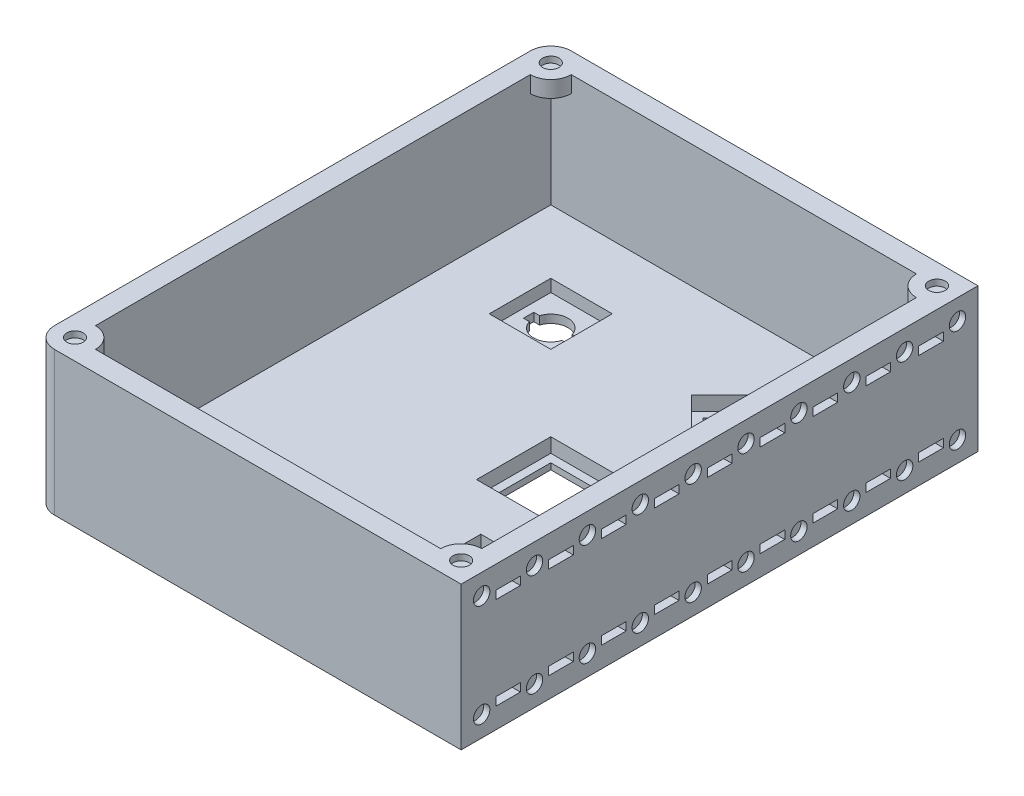
from build123d import *

# Parameters (mm, degrees)
SKETCH1_W               = 14.1
SKETCH1_H               = 14.1
BOSS_EXTRUDE1_DEPTH     = 5
BOSS_EXTRUDE2_START     = 30
SKETCH1_3_W             = 188.3
SKETCH1_3_H             = 116
BOSS_EXTRUDE2_DEPTH     = 30
SKETCH3_W               = 18.1
SKETCH3_H               = 18.1
CUT_EXTRUDE1_DEPTH      = 3.5
CUT_EXTRUDE2_DEPTH      = 231.718204743
CUT_EXTRUDE2_DEPTH_BACK = 231.718204743
SKETCH4_W               = 163.599092171
SKETCH4_H               = 164.279164307
SKETCH5_W               = 5
SKETCH5_H               = 126
BOSS_EXTRUDE3_DEPTH     = 35
BOSS_EXTRUDE4_DEPTH     = 4
CUT_EXTRUDE5_DEPTH      = 1.5
SKETCH9_W               = 15
SKETCH9_H               = 15
CUT_EXTRUDE6_DEPTH      = 3
SKETCH11_R              = 2
CUT_EXTRUDE7_DEPTH      = 1.5
LPATTERN1_COUNT         = 10
LPATTERN1_PITCH         = 12.888888889
LPATTERN1_COUNT_DIR2    = 2
LPATTERN1_PITCH_DIR2    = 25
SKETCH12_W              = 6
SKETCH12_H              = 2
CUT_EXTRUDE8_DEPTH      = 5
LPATTERN2_COUNT         = 9
LPATTERN2_PITCH         = 12.888888889
LPATTERN2_COUNT_DIR2    = 2
LPATTERN2_PITCH_DIR2    = 22.5


with BuildPart() as part:
    # Sketch1 → Boss-Extrude1 (new body)
    with BuildSketch(Plane(origin=(0, 0, 0), x_dir=(1, 0, 0), z_dir=(0, 1, 0))):
        with BuildLine():
            Line((-5, 116), (-5, 0))
            ThreePointArc((-5, 0), (-3.535533906, -3.535533906), (0, -5))
            Line((0, -5), (188.3, -5))
            ThreePointArc((188.3, -5), (191.835533906, -3.535533906), (193.3, 0))
            Line((193.3, 0), (193.3, 116))
            ThreePointArc((193.3, 116), (191.835533906, 119.535533906), (188.3, 121))
            Line((188.3, 121), (0, 121))
            ThreePointArc((0, 121), (-3.535533906, 119.535533906), (-5, 116))
        make_face()
        with Locations((58, 58)):
            Rectangle(SKETCH1_W, SKETCH1_H, mode=Mode.SUBTRACT)
        with Locations((82.1, 58)):
            Rectangle(SKETCH1_W, SKETCH1_H, mode=Mode.SUBTRACT)
        with Locations((70.05, 28.9)):
            Rectangle(SKETCH1_W, SKETCH1_H, mode=Mode.SUBTRACT)
        with Locations((118.25, 28.9)):
            Rectangle(SKETCH1_W, SKETCH1_H, mode=Mode.SUBTRACT)
        with Locations((106.2, 58)):
            Rectangle(SKETCH1_W, SKETCH1_H, mode=Mode.SUBTRACT)
        with Locations((130.3, 58)):
            Rectangle(SKETCH1_W, SKETCH1_H, mode=Mode.SUBTRACT)
        Polygon((80.020205615, 93), (70.05, 83.029794385), (60.079794385, 93), (70.05, 102.970205615), align=None, mode=Mode.SUBTRACT)
        Polygon((108.279794385, 93), (118.25, 102.970205615), (128.220205615, 93), (118.25, 83.029794385), align=None, mode=Mode.SUBTRACT)
        with BuildLine():
            Line((17.6, 94.25), (19.016518483, 94.25))
            ThreePointArc((19.016518483, 94.25), (23, 97.175), (26.983481517, 94.25))
            Line((26.983481517, 94.25), (28.4, 94.25))
            Line((28.4, 94.25), (28.4, 91.75))
            Line((28.4, 91.75), (26.983481517, 91.75))
            ThreePointArc((26.983481517, 91.75), (23, 88.825), (19.016518483, 91.75))
            Line((19.016518483, 91.75), (17.6, 91.75))
            Line((17.6, 91.75), (17.6, 94.25))
        make_face(mode=Mode.SUBTRACT)
        with BuildLine():
            Line((170.7, 91.75), (169.283481517, 91.75))
            ThreePointArc((169.283481517, 91.75), (165.3, 88.825), (161.316518483, 91.75))
            Line((161.316518483, 91.75), (159.9, 91.75))
            Line((159.9, 91.75), (159.9, 94.25))
            Line((159.9, 94.25), (161.316518483, 94.25))
            ThreePointArc((161.316518483, 94.25), (165.3, 97.175), (169.283481517, 94.25))
            Line((169.283481517, 94.25), (170.7, 94.25))
            Line((170.7, 94.25), (170.7, 91.75))
        make_face(mode=Mode.SUBTRACT)
    extrude(amount=-BOSS_EXTRUDE1_DEPTH)

    # Sketch1<3> → Boss-Extrude2 (add)
    with BuildSketch(Plane(origin=(0, 0, 0), x_dir=(1, 0, 0), z_dir=(0, 1, 0)).offset(BOSS_EXTRUDE2_START)):
        with BuildLine():
            Line((-5, 0), (-5, 116))
            ThreePointArc((-5, 116), (-3.535533906, 119.535533906), (0, 121))
            Line((0, 121), (188.3, 121))
            ThreePointArc((188.3, 121), (191.835533906, 119.535533906), (193.3, 116))
            Line((193.3, 116), (193.3, 0))
            ThreePointArc((193.3, 0), (191.835533906, -3.535533906), (188.3, -5))
            Line((188.3, -5), (0, -5))
            ThreePointArc((0, -5), (-3.535533906, -3.535533906), (-5, 0))
        make_face()
        with Locations((94.15, 58)):
            Rectangle(SKETCH1_3_W, SKETCH1_3_H, mode=Mode.SUBTRACT)
    extrude(amount=-BOSS_EXTRUDE2_DEPTH)

    # Sketch3 → Cut-Extrude1 (cut)
    with BuildSketch(Plane(origin=(0, 0, 0), x_dir=(1, 0, 0), z_dir=(0, 1, 0))):
        with Locations((58, 58)):
            Rectangle(SKETCH3_W, SKETCH3_H)
        Polygon((70.05, 105.798632739), (57.251367261, 93), (70.05, 80.201367261), (82.848632739, 93), align=None)
        with Locations((70.05, 28.9)):
            Rectangle(SKETCH3_W, SKETCH3_H)
        with Locations((82.1, 58)):
            Rectangle(SKETCH3_W, SKETCH3_H)
        with Locations((106.2, 58)):
            Rectangle(SKETCH3_W, SKETCH3_H)
        with Locations((130.3, 58)):
            Rectangle(SKETCH3_W, SKETCH3_H)
        Polygon((105.451367261, 93), (118.25, 80.201367261), (131.048632739, 93), (118.25, 105.798632739), align=None)
        with Locations((118.25, 28.9)):
            Rectangle(SKETCH3_W, SKETCH3_H)
    extrude(amount=-CUT_EXTRUDE1_DEPTH, mode=Mode.SUBTRACT)

    # Sketch4 → Cut-Extrude2 (cut, two sides: drawn at the far end of the back side and taken through both)
    with BuildSketch(Plane.XZ.offset(5).offset(-CUT_EXTRUDE2_DEPTH_BACK)):
        with Locations((175.949546086, -77.139582154)):
            Rectangle(SKETCH4_W, SKETCH4_H)
    extrude(amount=CUT_EXTRUDE2_DEPTH + CUT_EXTRUDE2_DEPTH_BACK, mode=Mode.SUBTRACT)

    # Sketch5 → Boss-Extrude3 (add)
    with BuildSketch(Plane.XZ.offset(5)):
        with Locations((96.65, -58)):
            Rectangle(SKETCH5_W, SKETCH5_H)
    extrude(amount=-BOSS_EXTRUDE3_DEPTH)

    # Sketch8 → Boss-Extrude4 (add)
    with BuildSketch(Plane(origin=(0, 30, 0), x_dir=(1, 0, 0), z_dir=(0, 1, 0))):
        with BuildLine():
            ThreePointArc((-5, 116), (-3.535533906, 112.464466094), (0, 111))
            Line((0, 111), (0, 114))
            ThreePointArc((0, 114), (-1.414213562, 117.414213562), (2, 116))
            Line((2, 116), (5, 116))
            ThreePointArc((5, 116), (3.535533906, 119.535533906), (0, 121))
            ThreePointArc((0, 121), (-3.535533906, 119.535533906), (-5, 116))
        make_face()
        with BuildLine():
            Line((0, 114), (0, 111))
            ThreePointArc((0, 111), (3.535533906, 112.464466094), (5, 116))
            Line((5, 116), (2, 116))
            ThreePointArc((2, 116), (1.414213562, 114.585786438), (0, 114))
        make_face()
        with BuildLine():
            Line((0, 116), (0, 114))
            ThreePointArc((0, 114), (1.414213562, 114.585786438), (2, 116))
            Line((2, 116), (0, 116))
        make_face()
        with BuildLine():
            ThreePointArc((2, 116), (-1.414213562, 117.414213562), (0, 114))
            Line((0, 114), (0, 116))
            Line((0, 116), (2, 116))
        make_face()
        with BuildLine():
            Line((92.15, 116), (89.15, 116))
            ThreePointArc((89.15, 116), (90.614466094, 112.464466094), (94.15, 111))
            Line((94.15, 111), (94.15, 114))
            ThreePointArc((94.15, 114), (92.735786438, 114.585786438), (92.15, 116))
        make_face()
        with BuildLine():
            ThreePointArc((99.15, 116), (94.15, 121), (89.15, 116))
            Line((89.15, 116), (92.15, 116))
            ThreePointArc((92.15, 116), (94.15, 118), (96.15, 116))
            ThreePointArc((96.15, 116), (95.564213562, 114.585786438), (94.15, 114))
            Line((94.15, 114), (94.15, 111))
            ThreePointArc((94.15, 111), (97.685533906, 112.464466094), (99.15, 116))
        make_face()
        with BuildLine():
            Line((94.15, 116), (92.15, 116))
            ThreePointArc((92.15, 116), (92.735786438, 114.585786438), (94.15, 114))
            Line((94.15, 114), (94.15, 116))
        make_face()
        with BuildLine():
            ThreePointArc((96.15, 116), (94.15, 118), (92.15, 116))
            Line((92.15, 116), (94.15, 116))
            Line((94.15, 116), (94.15, 114))
            ThreePointArc((94.15, 114), (95.564213562, 114.585786438), (96.15, 116))
        make_face()
        with BuildLine():
            Line((92.15, 0), (89.15, 0))
            ThreePointArc((89.15, 0), (94.15, -5), (99.15, 0))
            ThreePointArc((99.15, 0), (97.685533906, 3.535533906), (94.15, 5))
            Line((94.15, 5), (94.15, 2))
            ThreePointArc((94.15, 2), (95.564213562, 1.414213562), (96.15, 0))
            ThreePointArc((96.15, 0), (94.15, -2), (92.15, 0))
        make_face()
        with BuildLine():
            ThreePointArc((94.15, 5), (90.614466094, 3.535533906), (89.15, 0))
            Line((89.15, 0), (92.15, 0))
            ThreePointArc((92.15, 0), (92.735786438, 1.414213562), (94.15, 2))
            Line((94.15, 2), (94.15, 5))
        make_face()
        with BuildLine():
            Line((94.15, 0), (92.15, 0))
            ThreePointArc((92.15, 0), (94.15, -2), (96.15, 0))
            ThreePointArc((96.15, 0), (95.564213562, 1.414213562), (94.15, 2))
            Line((94.15, 2), (94.15, 0))
        make_face()
        with BuildLine():
            ThreePointArc((94.15, 2), (92.735786438, 1.414213562), (92.15, 0))
            Line((92.15, 0), (94.15, 0))
            Line((94.15, 0), (94.15, 2))
        make_face()
        with BuildLine():
            Line((0, 0), (0, 2))
            ThreePointArc((0, 2), (-1.414213562, -1.414213562), (2, 0))
            Line((2, 0), (0, 0))
        make_face()
        with BuildLine():
            ThreePointArc((2, 0), (1.414213562, 1.414213562), (0, 2))
            Line((0, 2), (0, 0))
            Line((0, 0), (2, 0))
        make_face()
        with BuildLine():
            ThreePointArc((0, 5), (-3.535533906, 3.535533906), (-5, 0))
            ThreePointArc((-5, 0), (-3.535533906, -3.535533906), (0, -5))
            ThreePointArc((0, -5), (3.535533906, -3.535533906), (5, 0))
            Line((5, 0), (2, 0))
            ThreePointArc((2, 0), (-1.414213562, -1.414213562), (0, 2))
            Line((0, 2), (0, 5))
        make_face()
        with BuildLine():
            ThreePointArc((5, 0), (3.535533906, 3.535533906), (0, 5))
            Line((0, 5), (0, 2))
            ThreePointArc((0, 2), (1.414213562, 1.414213562), (2, 0))
            Line((2, 0), (5, 0))
        make_face()
    extrude(amount=-BOSS_EXTRUDE4_DEPTH)

    # Sketch8<3> → Cut-Extrude5 (cut)
    with BuildSketch(Plane(origin=(0, 30, 0), x_dir=(1, 0, 0), z_dir=(0, 1, 0))):
        with BuildLine():
            Line((0, 0), (2, 0))
            ThreePointArc((2, 0), (1.414213562, 1.414213562), (0, 2))
            Line((0, 2), (0, 0))
        make_face()
        with BuildLine():
            ThreePointArc((0, 2), (-1.414213562, -1.414213562), (2, 0))
            Line((2, 0), (0, 0))
            Line((0, 0), (0, 2))
        make_face()
        with BuildLine():
            Line((0, 116), (0, 114))
            ThreePointArc((0, 114), (1.414213562, 114.585786438), (2, 116))
            Line((2, 116), (0, 116))
        make_face()
        with BuildLine():
            ThreePointArc((2, 116), (-1.414213562, 117.414213562), (0, 114))
            Line((0, 114), (0, 116))
            Line((0, 116), (2, 116))
        make_face()
        with BuildLine():
            Line((94.15, 116), (94.15, 114))
            ThreePointArc((94.15, 114), (95.564213562, 114.585786438), (96.15, 116))
            ThreePointArc((96.15, 116), (94.15, 118), (92.15, 116))
            Line((92.15, 116), (94.15, 116))
        make_face()
        with BuildLine():
            ThreePointArc((92.15, 116), (92.735786438, 114.585786438), (94.15, 114))
            Line((94.15, 114), (94.15, 116))
            Line((94.15, 116), (92.15, 116))
        make_face()
        with BuildLine():
            Line((94.15, 0), (92.15, 0))
            ThreePointArc((92.15, 0), (94.15, -2), (96.15, 0))
            ThreePointArc((96.15, 0), (95.564213562, 1.414213562), (94.15, 2))
            Line((94.15, 2), (94.15, 0))
        make_face()
        with BuildLine():
            ThreePointArc((94.15, 2), (92.735786438, 1.414213562), (92.15, 0))
            Line((92.15, 0), (94.15, 0))
            Line((94.15, 0), (94.15, 2))
        make_face()
    extrude(amount=-CUT_EXTRUDE5_DEPTH, mode=Mode.SUBTRACT)

    # Sketch9 → Cut-Extrude6 (cut)
    with BuildSketch(Plane(origin=(0, 0, 0), x_dir=(1, 0, 0), z_dir=(0, 1, 0))):
        with Locations((23, 93)):
            Rectangle(SKETCH9_W, SKETCH9_H)
    extrude(amount=-CUT_EXTRUDE6_DEPTH, mode=Mode.SUBTRACT)

    # Sketch11 → Cut-Extrude7 (cut)
    with BuildSketch(Plane(origin=(99.15, 0, 0), x_dir=(0, 0, -1), z_dir=(1, 0, 0))):
        Circle(SKETCH11_R)
    cut_extrude7 = extrude(amount=-CUT_EXTRUDE7_DEPTH, mode=Mode.SUBTRACT)

    # LPattern1: Cut-Extrude7 10 × 2
    with Locations(*[(0, j * LPATTERN1_PITCH_DIR2, -i * LPATTERN1_PITCH) for i in range(LPATTERN1_COUNT) for j in range(LPATTERN1_COUNT_DIR2) if (i, j) != (0, 0)]):
        add(cut_extrude7, mode=Mode.SUBTRACT)

    # Sketch12 → Cut-Extrude8 (cut)
    with BuildSketch(Plane(origin=(99.15, 0, 0), x_dir=(0, 0, -1), z_dir=(1, 0, 0))):
        with Locations((6.444444444, 1)):
            Rectangle(SKETCH12_W, SKETCH12_H)
    cut_extrude8 = extrude(amount=-CUT_EXTRUDE8_DEPTH, mode=Mode.SUBTRACT)

    # LPattern2: Cut-Extrude8 9 × 2
    with Locations(*[(0, j * LPATTERN2_PITCH_DIR2, -i * LPATTERN2_PITCH) for i in range(LPATTERN2_COUNT) for j in range(LPATTERN2_COUNT_DIR2) if (i, j) != (0, 0)]):
        add(cut_extrude8, mode=Mode.SUBTRACT)


solid = part.part
